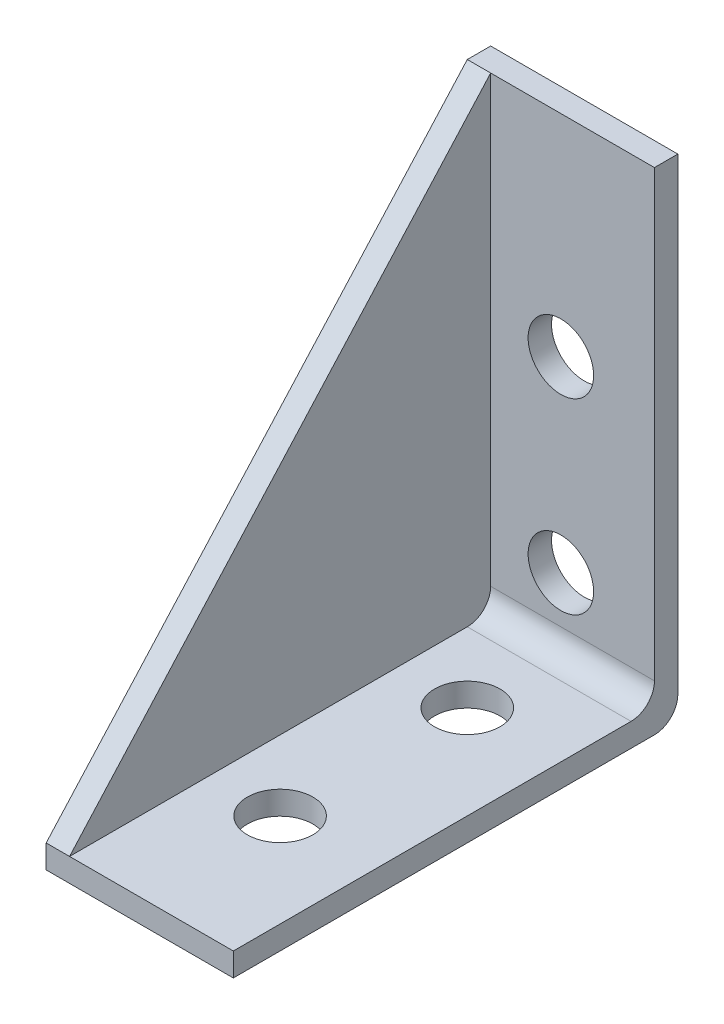
from build123d import *

# Parameters (mm, degrees)
CROQUIS1_W              = 40
CROQUIS1_H              = 105
SALIENTE_EXTRUIR1_DEPTH = 5
CROQUIS2_R              = 7
CORTAR_EXTRUIR1_DEPTH   = 5
CROQUIS2_3_R            = 7
CORTAR_EXTRUIR2_DEPTH   = 5
CROQUIS4_W              = 40
CROQUIS4_H              = 5
SALIENTE_EXTRUIR2_DEPTH = 90
CROQUIS5_R              = 7
CORTAR_EXTRUIR3_DEPTH   = 90
CROQUIS5_3_R            = 7
CORTAR_EXTRUIR4_DEPTH   = 90
REDONDEO3_R             = 5
REDONDEO4_R             = 5
SALIENTE_EXTRUIR3_START = -5
SALIENTE_EXTRUIR3_DEPTH = 5


with BuildPart() as part:
    # Croquis1 → Saliente-Extruir1 (new body)
    with BuildSketch(Plane.XY):
        with Locations((20, 52.5)):
            Rectangle(CROQUIS1_W, CROQUIS1_H)
    extrude(amount=SALIENTE_EXTRUIR1_DEPTH)

    # Croquis2 → Cortar-Extruir1 (cut)
    with BuildSketch(Plane.XY.offset(5)):
        with Locations((20, 60)):
            Circle(CROQUIS2_R)
    extrude(amount=-CORTAR_EXTRUIR1_DEPTH, mode=Mode.SUBTRACT)

    # Croquis2<3> → Cortar-Extruir2 (cut)
    with BuildSketch(Plane.XY.offset(5)):
        with Locations((20, 20)):
            Circle(CROQUIS2_3_R)
    extrude(amount=-CORTAR_EXTRUIR2_DEPTH, mode=Mode.SUBTRACT)

    # Croquis4 → Saliente-Extruir2 (add)
    with BuildSketch(Plane.XY.offset(5)):
        with Locations((20, 2.5)):
            Rectangle(CROQUIS4_W, CROQUIS4_H)
    extrude(amount=SALIENTE_EXTRUIR2_DEPTH)

    # Croquis5 → Cortar-Extruir3 (cut)
    with BuildSketch(Plane(origin=(0, 5, 0), x_dir=(1, 0, 0), z_dir=(0, 1, 0))):
        with Locations((20, -25)):
            Circle(CROQUIS5_R)
    extrude(amount=-CORTAR_EXTRUIR3_DEPTH, mode=Mode.SUBTRACT)

    # Croquis5<3> → Cortar-Extruir4 (cut)
    with BuildSketch(Plane(origin=(0, 5, 0), x_dir=(1, 0, 0), z_dir=(0, 1, 0))):
        with Locations((20, -25)):
            Circle(CROQUIS5_3_R)
        with Locations((20, -65)):
            Circle(CROQUIS5_3_R)
    extrude(amount=-CORTAR_EXTRUIR4_DEPTH, mode=Mode.SUBTRACT)

    # Redondeo3
    redondeo3_edges = [part.edges().sort_by_distance(p)[0] for p in [
        (20, 5, 5),
    ]]
    fillet(redondeo3_edges, radius=REDONDEO3_R)

    # Redondeo4
    redondeo4_edges = [part.edges().sort_by_distance(p)[0] for p in [
        (20, 0, 0),
    ]]
    fillet(redondeo4_edges, radius=REDONDEO4_R)

    # Croquis6 → Saliente-Extruir3 (add)
    with BuildSketch(Plane.ZY.offset(SALIENTE_EXTRUIR3_START)):
        with BuildLine():
            Line((5, 105), (95, 5))
            Line((95, 5), (10, 5))
            ThreePointArc((10, 5), (6.464466094, 6.464466094), (5, 10))
            Line((5, 10), (5, 105))
        make_face()
    extrude(amount=SALIENTE_EXTRUIR3_DEPTH)


solid = part.part
